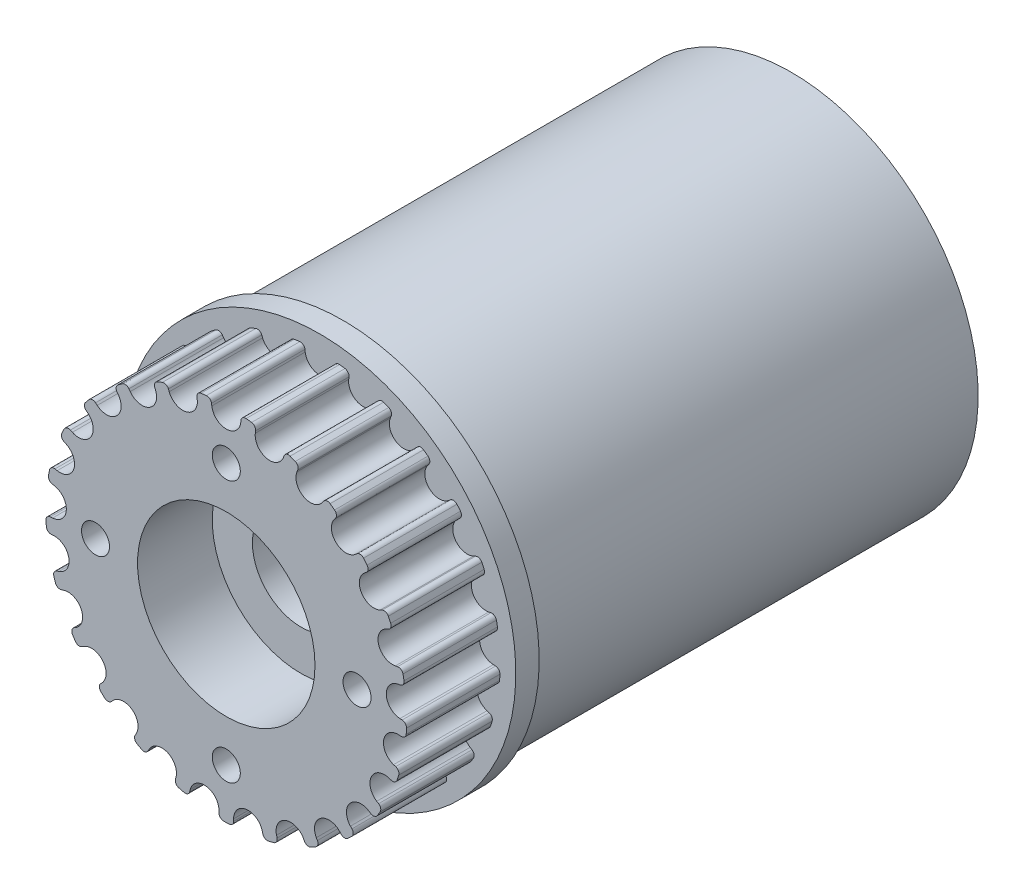
from build123d import *

# Parameters (mm, degrees)
SKETCH_1_R               = 19.894367886
EXTRUDE_1_DEPTH          = 68.5
CUT_EXTRUDE_1_DEPTH      = 75.052830785
PATTERN_CIRCULAR_1_COUNT = 25
SKETCH_3_R               = 21
EXTRUDE_2_DEPTH          = 1
SKETCH_4_R               = 20
EXTRUDE_3_DEPTH          = 45
SKETCH_5_R               = 21
EXTRUDE_4_DEPTH          = 2.5
SKETCH_6_R               = 5.2
CUT_EXTRUDE_2_DEPTH      = 75.660900075
SKETCH_6_3_R             = 9.5
SKETCH_6_3_R_2           = 5.2
CUT_EXTRUDE_3_DEPTH      = 13
CUT_EXTRUDE_START        = -60.5
SKETCH_6_4_R             = 9.5
SKETCH_6_4_R_2           = 5.2
CUT_EXTRUDE_4_DEPTH      = 8
SKETCH_7_R               = 1.5
CUT_EXTRUDE_5_DEPTH      = 75.660900075
CUT_EXTRUDE_6_REACH      = 66.717
SKETCH_8_R               = 21
SKETCH_9_R               = 9.5
CUT_EXTRUDE_7_DEPTH      = 6
EXTRUDE_START            = 3
SKETCH_10_R              = 20
SKETCH_10_R_2            = 1.5
SKETCH_10_R_3            = 9.5
EXTRUDE_5_DEPTH          = 3


with BuildPart() as part:
    # 草图1 → 凸台-拉伸1 (new body)
    with BuildSketch(Plane.XY):
        Circle(SKETCH_1_R)
    extrude(amount=EXTRUDE_1_DEPTH)

    # 草图2 → 切除-拉伸1 (cut, through all)
    with BuildSketch(Plane.XY.offset(68.5)):
        with BuildLine():
            Line((1.577407148, 18.768724044), (1.548371997, 18.532251711))
            ThreePointArc((1.548371997, 18.532251711), (0, 17.162367886), (-1.548371997, 18.532251711))
            Line((-1.548371997, 18.532251711), (-1.577407148, 18.768724044))
            ThreePointArc((-1.577407148, 18.768724044), (-1.763534561, 19.099975129), (-2.128765754, 19.204745692))
            ThreePointArc((-2.128765754, 19.204745692), (-2.275316606, 19.187934623), (-2.421734847, 19.170005244))
            Line((-2.421734847, 19.170005244), (-2.493425457, 19.737494854))
            ThreePointArc((-2.493425457, 19.737494854), (0, 19.894367886), (2.493425457, 19.737494854))
            Line((2.493425457, 19.737494854), (2.421734847, 19.170005244))
            ThreePointArc((2.421734847, 19.170005244), (2.275316606, 19.187934623), (2.128765754, 19.204745692))
            ThreePointArc((2.128765754, 19.204745692), (1.763534561, 19.099975129), (1.577407148, 18.768724044))
        make_face()
    cut_extrude_1 = extrude(amount=-CUT_EXTRUDE_1_DEPTH, mode=Mode.SUBTRACT)

    # 阵列(圆周)1: 切除-拉伸1 ×25 about axis
    pattern_circular_1_axis = Axis((0, 0, 0), (0, 0, 1))
    for i in range(1, PATTERN_CIRCULAR_1_COUNT):
        add(cut_extrude_1.rotate(pattern_circular_1_axis, i * 360 / PATTERN_CIRCULAR_1_COUNT), mode=Mode.SUBTRACT)

    # 草图3 → 凸台-拉伸2 (add)
    with BuildSketch(Plane(origin=(0, 0, 10), x_dir=(-1, 0, 0), z_dir=(0, 0, -1))):
        Circle(SKETCH_3_R)
    extrude(amount=-EXTRUDE_2_DEPTH)

    # 草图4 → 凸台-拉伸3 (add)
    with BuildSketch(Plane(origin=(0, 0, 11), x_dir=(-1, 0, 0), z_dir=(0, 0, -1))):
        Circle(SKETCH_4_R)
    extrude(amount=-EXTRUDE_3_DEPTH)

    # 草图5 → 凸台-拉伸4 (add)
    with BuildSketch(Plane(origin=(0, 0, 56), x_dir=(-1, 0, 0), z_dir=(0, 0, -1))):
        Circle(SKETCH_5_R)
    extrude(amount=-EXTRUDE_4_DEPTH)

    # 草图6 → 切除-拉伸2 (cut, through all)
    with BuildSketch(Plane(origin=(0, 0, 0), x_dir=(-1, 0, 0), z_dir=(0, 0, -1))):
        Circle(SKETCH_6_R)
    extrude(amount=-CUT_EXTRUDE_2_DEPTH, mode=Mode.SUBTRACT)

    # 草图6<3> → 切除-拉伸3 (cut)
    with BuildSketch(Plane(origin=(0, 0, 0), x_dir=(-1, 0, 0), z_dir=(0, 0, -1))):
        Circle(SKETCH_6_3_R)
        Circle(SKETCH_6_3_R_2, mode=Mode.SUBTRACT)
    extrude(amount=-CUT_EXTRUDE_3_DEPTH, mode=Mode.SUBTRACT)

    # 草图6<4> → 切除-拉伸4 (cut)
    with BuildSketch(Plane(origin=(0, 0, 0), x_dir=(-1, 0, 0), z_dir=(0, 0, -1)).offset(CUT_EXTRUDE_START)):
        Circle(SKETCH_6_4_R)
        Circle(SKETCH_6_4_R_2, mode=Mode.SUBTRACT)
    extrude(amount=-CUT_EXTRUDE_4_DEPTH, mode=Mode.SUBTRACT)

    # 草图7 → 切除-拉伸5 (cut, through all)
    with BuildSketch(Plane(origin=(0, 0, 0), x_dir=(-1, 0, 0), z_dir=(0, 0, -1))):
        with Locations((14, 0)):
            Circle(SKETCH_7_R)
        with Locations((0, 14)):
            Circle(SKETCH_7_R)
        with Locations((-14, 0)):
            Circle(SKETCH_7_R)
        with Locations((0, -14)):
            Circle(SKETCH_7_R)
    extrude(amount=-CUT_EXTRUDE_5_DEPTH, mode=Mode.SUBTRACT)

    # 草图8 → 切除-拉伸6 (cut, up to next)
    with BuildSketch(Plane.XY.offset(11), mode=Mode.PRIVATE) as cut_extrude_6_sk1:
        with Locations(Location((0, 0, 0), (0, 0, 180))):
            Circle(SKETCH_8_R)
    cut_extrude_6_tool1 = extrude(cut_extrude_6_sk1.sketch, amount=-CUT_EXTRUDE_6_REACH, mode=Mode.PRIVATE) & part.part
    add(cut_extrude_6_tool1.solids().sort_by_distance((0, 0, 11))[0], mode=Mode.SUBTRACT)

    # 草图9 → 切除-拉伸7 (cut)
    with BuildSketch(Plane(origin=(0, 0, 13), x_dir=(-1, 0, 0), z_dir=(0, 0, -1))):
        Circle(SKETCH_9_R)
    extrude(amount=-CUT_EXTRUDE_7_DEPTH, mode=Mode.SUBTRACT)

    # 草图10 → 凸台-拉伸5 (add)
    with BuildSketch(Plane(origin=(0, 0, 11), x_dir=(-1, 0, 0), z_dir=(0, 0, -1)).offset(EXTRUDE_START)):
        Circle(SKETCH_10_R)
        with Locations((-14, 0)):
            Circle(SKETCH_10_R_2, mode=Mode.SUBTRACT)
        with Locations((0, -14)):
            Circle(SKETCH_10_R_2, mode=Mode.SUBTRACT)
        with Locations((14, 0)):
            Circle(SKETCH_10_R_2, mode=Mode.SUBTRACT)
        with Locations((0, 14)):
            Circle(SKETCH_10_R_2, mode=Mode.SUBTRACT)
        Circle(SKETCH_10_R_3, mode=Mode.SUBTRACT)
    extrude(amount=-EXTRUDE_5_DEPTH)


solid = part.part
